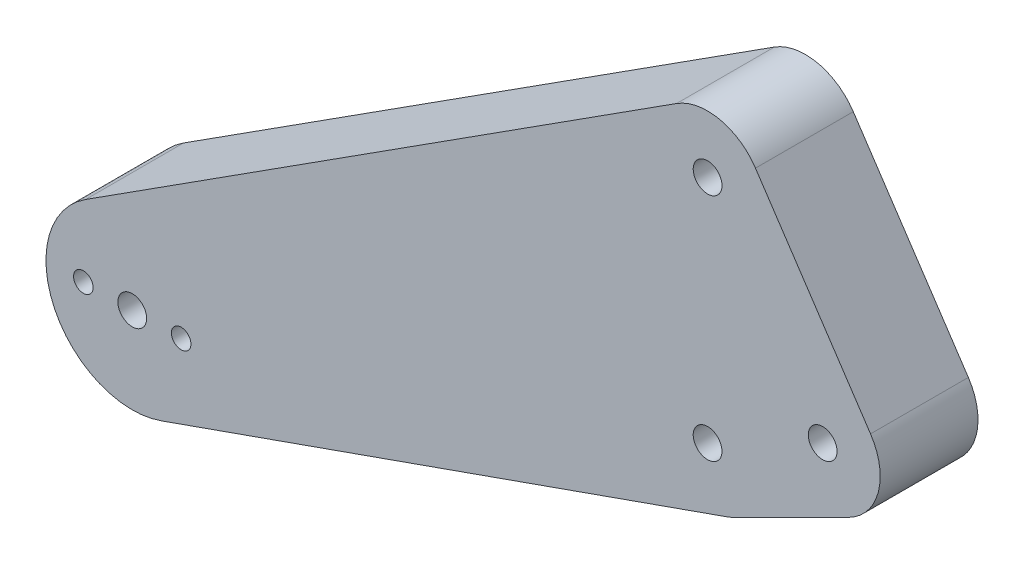
from build123d import *

# Parameters (mm, degrees)
BOSS_EXTRUDE1_DEPTH = 17
SKETCH2_R           = 2.5
CUT_EXTRUDE1_DEPTH  = 127.546434165
SKETCH3_R           = 1.7
CUT_EXTRUDE2_DEPTH  = 127.546434165


with BuildPart() as part:
    # Sketch1 → Boss-Extrude1 (new body)
    with BuildSketch(Plane.XY):
        with BuildLine():
            Line((3.328897286, -9.429657621), (-95.00665407, -44.144486432))
            ThreePointArc((-95.00665407, -44.144486432), (-113.476816743, -36.586001098), (-108.091360043, -17.369485653))
            Line((-108.091360043, -17.369485653), (-5.394240028, 48.420342898))
            ThreePointArc((-5.394240028, 48.420342898), (2.050554972, 49.787503477), (8.320502943, 45.547001962))
            Line((8.320502943, 45.547001962), (28.320502943, 15.547001962))
            ThreePointArc((28.320502943, 15.547001962), (29.664996488, 7.433320648), (24.472135955, 1.05572809))
            Line((24.472135955, 1.05572809), (4.472135955, -8.94427191))
            ThreePointArc((4.472135955, -8.94427191), (3.908059586, -9.204730863), (3.328897286, -9.429657621))
        make_face()
    extrude(amount=BOSS_EXTRUDE1_DEPTH)

    # Sketch2 → Cut-Extrude1 (cut, through all)
    with BuildSketch(Plane.XY.offset(17)):
        with Locations((-100, -30)):
            Circle(SKETCH2_R)
        Circle(SKETCH2_R)
        with Locations((0, 40)):
            Circle(SKETCH2_R)
        with Locations((20, 10)):
            Circle(SKETCH2_R)
    extrude(amount=-CUT_EXTRUDE1_DEPTH, mode=Mode.SUBTRACT)

    # Sketch3 → Cut-Extrude2 (cut, through all)
    with BuildSketch(Plane.XY.offset(17)):
        with Locations((-108.5, -30)):
            Circle(SKETCH3_R)
        with Locations((-91.5, -30)):
            Circle(SKETCH3_R)
    extrude(amount=-CUT_EXTRUDE2_DEPTH, mode=Mode.SUBTRACT)


solid = part.part
